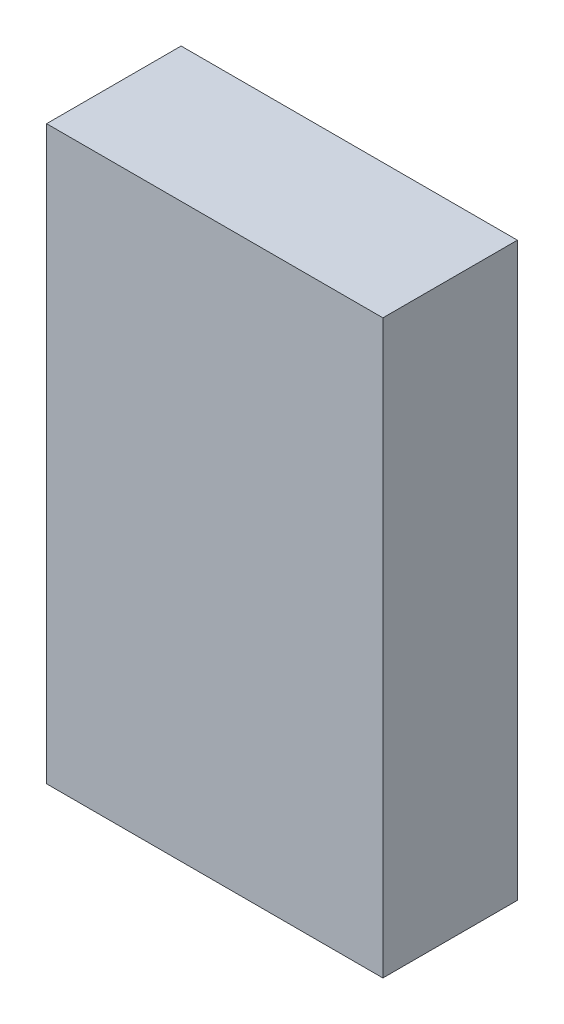
from build123d import *

# Parameters (mm, degrees)
SKETCH1_W           = 50.8
SKETCH1_H           = 20.32
BOSS_EXTRUDE1_DEPTH = 86.36


with BuildPart() as part:
    # Sketch1 → Boss-Extrude1 (new body)
    with BuildSketch(Plane(origin=(0, 0, 0), x_dir=(1, 0, 0), z_dir=(0, 1, 0))):
        Rectangle(SKETCH1_W, SKETCH1_H)
    extrude(amount=BOSS_EXTRUDE1_DEPTH)


solid = part.part
